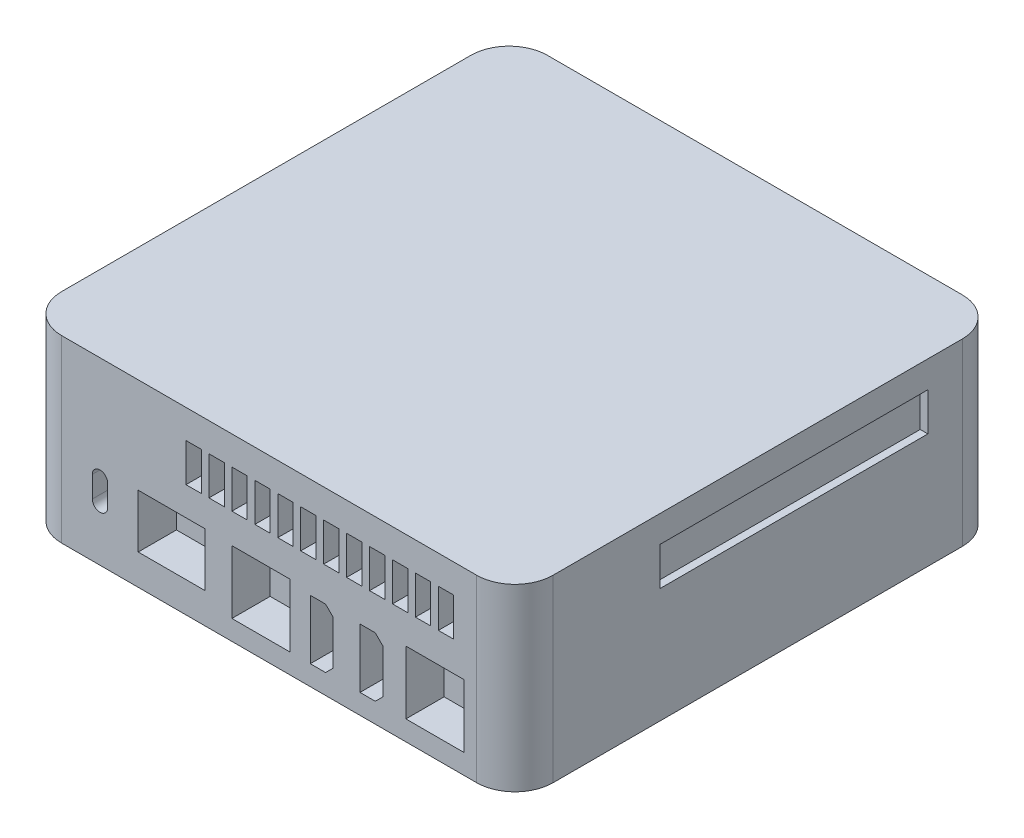
from build123d import *

# Parameters (mm, degrees)
SKETCH1_W                                     = 128.5
SKETCH1_H                                     = 127
GABARYT_DEPTH                                 = 47
SKETCH2_W                                     = 17.5
SKETCH2_H                                     = 14
SKETCH2_W_2                                   = 15.2
SKETCH2_H_2                                   = 16.5
PORTY_USBC_ETHERNET_2XUSBA_HDMI_HDMI_2X_DEPTH = 10
SKETCH3_W                                     = 4
SKETCH3_H                                     = 10
VENTS_OUTLET_1_DEPTH                          = 10
SKETCH4_W                                     = 4
SKETCH4_H                                     = 10
VENTS_OUTLET_2_DEPTH                          = 10
VENTS_START                                   = -127
SKETCH3_3_W                                   = 70
SKETCH3_3_H                                   = 10
VENTS_INLET_1_DEPTH                           = 2
VENTS_START_2                                 = -128.5
SKETCH4_3_W                                   = 70
SKETCH4_3_H                                   = 10
VENTS_INLET_2_DEPTH                           = 2
SKETCH5_R                                     = 3.25
SKETCH5_W                                     = 10
SKETCH5_H                                     = 5.5
PORTY_ON_AUDIOJACK_USBC_USBC_DEPTH            = 10
TAP_DRILL_FOR_M4_TAP1_D                       = 3.3
TAP_DRILL_FOR_M4_TAP1_DEPTH                   = 6
TAP_DRILL_FOR_M4_TAP1_TIP                     = 0.991420021
FILLET1_R                                     = 10


with BuildPart() as part:
    # Sketch1 → gabaryt (new body)
    with BuildSketch(Plane(origin=(0, 0, 0), x_dir=(1, 0, 0), z_dir=(0, 1, 0))):
        with Locations((64.25, 63.5)):
            Rectangle(SKETCH1_W, SKETCH1_H)
    extrude(amount=GABARYT_DEPTH)

    # Sketch2 → porty (usbc/ethernet/2xUSBa/hdmi/hdmi/2xUSBa) (cut)
    with BuildSketch(Plane.XY):
        with BuildLine():
            Line((22, 19.6), (22, 14))
            ThreePointArc((22, 14), (20, 12), (18, 14))
            Line((18, 14), (18, 19.6))
            ThreePointArc((18, 19.6), (20, 21.6), (22, 19.6))
        make_face()
        Polygon((75, 20.7), (75, 5.2), (79, 5.2), (81, 7.2), (81, 18.7), (79, 20.7), align=None)
        with Locations((38.75, 15)):
            Rectangle(SKETCH2_W, SKETCH2_H)
        with Locations((62.1, 13.45)):
            Rectangle(SKETCH2_W_2, SKETCH2_H_2)
        Polygon((88, 20.7), (88, 5.2), (92, 5.2), (94, 7.2), (94, 18.7), (92, 20.7), align=None)
        with Locations((107.6, 13.45)):
            Rectangle(SKETCH2_W_2, SKETCH2_H_2)
    extrude(amount=-PORTY_USBC_ETHERNET_2XUSBA_HDMI_HDMI_2X_DEPTH, mode=Mode.SUBTRACT)

    # Sketch3 → vents outlet 1 (cut)
    with BuildSketch(Plane.XY):
        with Locations((44.5, 34.5)):
            Rectangle(SKETCH3_W, SKETCH3_H)
        with Locations((50.5, 34.5)):
            Rectangle(SKETCH3_W, SKETCH3_H)
        with Locations((56.5, 34.5)):
            Rectangle(SKETCH3_W, SKETCH3_H)
        with Locations((62.5, 34.5)):
            Rectangle(SKETCH3_W, SKETCH3_H)
        with Locations((68.5, 34.5)):
            Rectangle(SKETCH3_W, SKETCH3_H)
        with Locations((74.5, 34.5)):
            Rectangle(SKETCH3_W, SKETCH3_H)
        with Locations((80.5, 34.5)):
            Rectangle(SKETCH3_W, SKETCH3_H)
        with Locations((86.5, 34.5)):
            Rectangle(SKETCH3_W, SKETCH3_H)
        with Locations((92.5, 34.5)):
            Rectangle(SKETCH3_W, SKETCH3_H)
        with Locations((98.5, 34.5)):
            Rectangle(SKETCH3_W, SKETCH3_H)
        with Locations((104.5, 34.5)):
            Rectangle(SKETCH3_W, SKETCH3_H)
        with Locations((110.5, 34.5)):
            Rectangle(SKETCH3_W, SKETCH3_H)
    extrude(amount=-VENTS_OUTLET_1_DEPTH, mode=Mode.SUBTRACT)

    # Sketch4 → vents outlet 2 (cut)
    with BuildSketch(Plane.ZY):
        with Locations((-106, 35)):
            Rectangle(SKETCH4_W, SKETCH4_H)
        with Locations((-100, 35)):
            Rectangle(SKETCH4_W, SKETCH4_H)
        with Locations((-94, 35)):
            Rectangle(SKETCH4_W, SKETCH4_H)
        with Locations((-88, 35)):
            Rectangle(SKETCH4_W, SKETCH4_H)
        with Locations((-82, 35)):
            Rectangle(SKETCH4_W, SKETCH4_H)
        with Locations((-76, 35)):
            Rectangle(SKETCH4_W, SKETCH4_H)
        with Locations((-70, 35)):
            Rectangle(SKETCH4_W, SKETCH4_H)
        with Locations((-64, 35)):
            Rectangle(SKETCH4_W, SKETCH4_H)
        with Locations((-58, 35)):
            Rectangle(SKETCH4_W, SKETCH4_H)
        with Locations((-52, 35)):
            Rectangle(SKETCH4_W, SKETCH4_H)
        with Locations((-46, 35)):
            Rectangle(SKETCH4_W, SKETCH4_H)
        with Locations((-40, 35)):
            Rectangle(SKETCH4_W, SKETCH4_H)
    extrude(amount=-VENTS_OUTLET_2_DEPTH, mode=Mode.SUBTRACT)

    # Sketch3<3> → vents inlet 1 (cut)
    with BuildSketch(Plane.XY.offset(VENTS_START)):
        with Locations((77.5, 34.5)):
            Rectangle(SKETCH3_3_W, SKETCH3_3_H)
    extrude(amount=VENTS_INLET_1_DEPTH, mode=Mode.SUBTRACT)

    # Sketch4<3> → vents inlet 2 (cut)
    with BuildSketch(Plane.ZY.offset(VENTS_START_2)):
        with Locations((-73, 35)):
            Rectangle(SKETCH4_3_W, SKETCH4_3_H)
    extrude(amount=VENTS_INLET_2_DEPTH, mode=Mode.SUBTRACT)

    # Sketch5 → porty (on/audiojack/USBc/USBc) (cut)
    with BuildSketch(Plane(origin=(0, 0, -127), x_dir=(-1, 0, 0), z_dir=(0, 0, -1))):
        with Locations((-74.25, 17.25)):
            Circle(SKETCH5_R)
        with Locations((-90.5, 17.25)):
            Rectangle(SKETCH5_W, SKETCH5_H)
        with BuildLine():
            Line((-60.5, 19.25), (-54.5, 19.25))
            ThreePointArc((-54.5, 19.25), (-52.5, 17.25), (-54.5, 15.25))
            Line((-54.5, 15.25), (-60.5, 15.25))
            ThreePointArc((-60.5, 15.25), (-62.5, 17.25), (-60.5, 19.25))
        make_face()
        with BuildLine():
            Line((-41, 19.25), (-35, 19.25))
            ThreePointArc((-35, 19.25), (-33, 17.25), (-35, 15.25))
            Line((-35, 15.25), (-41, 15.25))
            ThreePointArc((-41, 15.25), (-43, 17.25), (-41, 19.25))
        make_face()
    extrude(amount=-PORTY_ON_AUDIOJACK_USBC_USBC_DEPTH, mode=Mode.SUBTRACT)

    # Tap Drill for M4 Tap1
    with Locations(Plane(origin=(0, 0, 0), x_dir=(-1, 0, 0), z_dir=(0, -1, 0))):
        with Locations((-64.25, 106), (-64.25, 21)):
            Hole(TAP_DRILL_FOR_M4_TAP1_D / 2, depth=TAP_DRILL_FOR_M4_TAP1_DEPTH)
            with Locations((0, 0, -(TAP_DRILL_FOR_M4_TAP1_DEPTH + TAP_DRILL_FOR_M4_TAP1_TIP / 2))):  # 118° drill point
                Cone(0, TAP_DRILL_FOR_M4_TAP1_D / 2, TAP_DRILL_FOR_M4_TAP1_TIP, mode=Mode.SUBTRACT)

    # Fillet1
    fillet1_edges = [part.edges().sort_by_distance(p)[0] for p in [
        (0, 23.5, -127),
        (128.5, 23.5, -127),
        (128.5, 23.5, 0),
        (0, 23.5, 0),
    ]]
    fillet(fillet1_edges, radius=FILLET1_R)


solid = part.part
